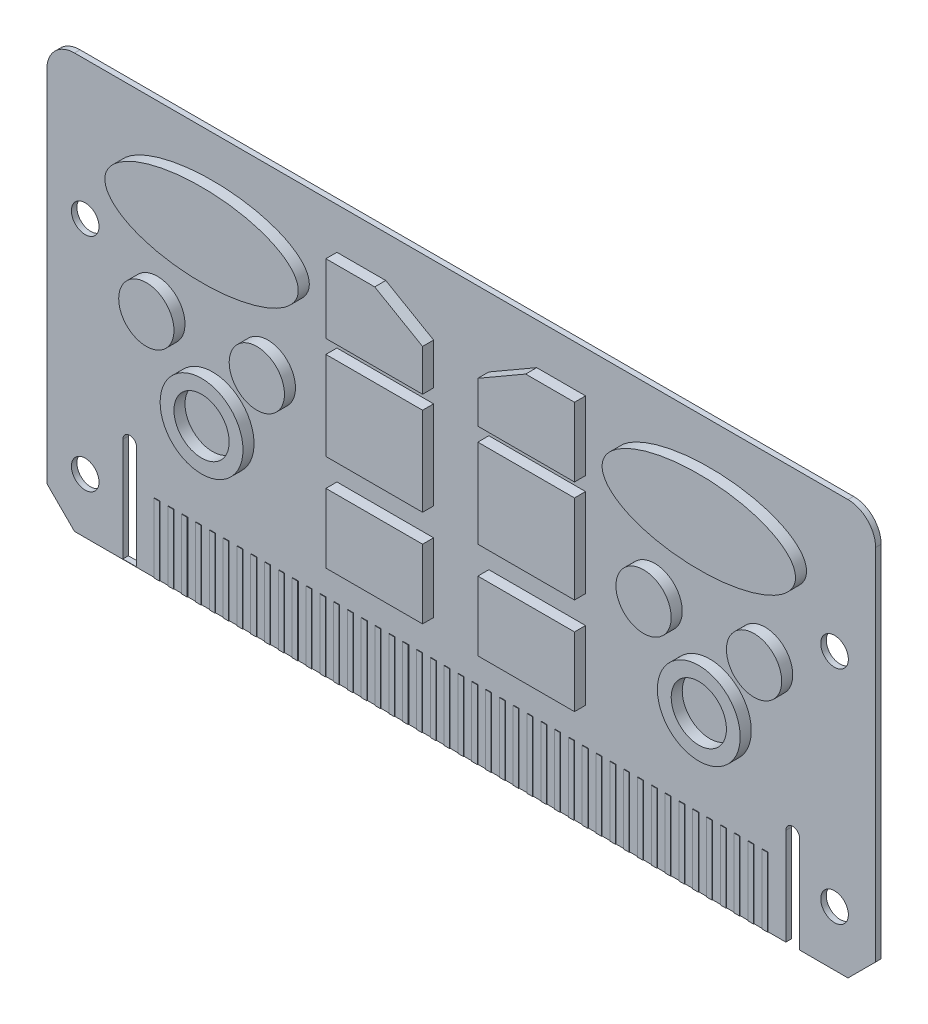
from build123d import *

# Parameters (mm, degrees)
PRINTED_CIRCUITBOARD_BASE_DEPTH = 1
SKETCH2_R                       = 10
SKETCH2_R_2                     = 15
SKETCH2_RX                      = 35
SKETCH2_RY                      = 15
SKETCH2_W                       = 35
SKETCH2_H                       = 25
SKETCH2_H_2                     = 32
CHIPS_DEPTH                     = 4
SLOT_CUTS_DEPTH                 = 10
F_10MM_DOWEL_HOLE_D             = 10.0000054
SKETCH6_W                       = 2
SKETCH6_H                       = 25
LINEAR_SKETCH_PATTERN_DEPTH     = 0.2
FILLETS_R                       = 10
CHAMFERS_SIZE                   = 10


with BuildPart() as part:
    # Sketch1 → Printed CircuitBoard Base (new, symmetric)
    with BuildSketch(Plane.XY):
        Polygon((-299.581607865, 149.862186508), (-299.581607865, -0.137813492), (0.418391866, -0.137813492), (0.418391866, 149.849499231), align=None)
    extrude(amount=PRINTED_CIRCUITBOARD_BASE_DEPTH, both=True)

    # Sketch2 → Chips (add)
    # profile 1 of 14: a face of its own
    with BuildSketch(Plane.XY.offset(1)):
        with Locations((-259.581607865, 84.862186508)):
            Circle(SKETCH2_R)
    # profile 2 of 14: a face of its own
    with BuildSketch(Plane.XY.offset(1)):
        with Locations((-219.581607865, 84.862186508)):
            Circle(SKETCH2_R)
    # profile 3 of 14: a face of its own
    with BuildSketch(Plane.XY.offset(1)):
        with Locations((-239.581607865, 59.862186508)):
            Circle(SKETCH2_R_2)
        with Locations((-239.581607865, 59.862186508)):
            Circle(SKETCH2_R, mode=Mode.SUBTRACT)
    # profile 4 of 14: a face of its own
    with BuildSketch(Plane.XY.offset(1)):
        with Locations((-59.581608134, 59.862186508)):
            Circle(SKETCH2_R_2)
        with Locations((-59.581608134, 59.862186508)):
            Circle(SKETCH2_R, mode=Mode.SUBTRACT)
    # profile 5 of 14: a face of its own
    with BuildSketch(Plane.XY.offset(1)):
        with Locations((-79.581608134, 84.862186508)):
            Circle(SKETCH2_R)
    # profile 6 of 14: a face of its own
    with BuildSketch(Plane.XY.offset(1)):
        with Locations((-39.581608134, 84.862186508)):
            Circle(SKETCH2_R)
    # profile 7 of 14: a face of its own
    with BuildSketch(Plane.XY.offset(1)):
        with Locations(Location((-239.581607865, 119.862186508), (0, 0, 0))):
            Ellipse(SKETCH2_RX, SKETCH2_RY)
    # profile 8 of 14: a face of its own
    with BuildSketch(Plane.XY.offset(1)):
        with Locations((-59.581608134, 119.862186508)):
            Ellipse(SKETCH2_RX, SKETCH2_RY)
    # profile 9 of 14: a face of its own
    with BuildSketch(Plane.XY.offset(1)):
        Polygon((-159.581608134, 124.862186508), (-176.902116209, 134.862186508), (-194.581608134, 134.862186508), (-194.581608134, 109.862186508), (-159.581608134, 109.862186508), align=None)
    # profile 10 of 14: a face of its own
    with BuildSketch(Plane.XY.offset(1)):
        with Locations((-177.081608134, 50.362186508)):
            Rectangle(SKETCH2_W, SKETCH2_H)
    # profile 11 of 14: a face of its own
    with BuildSketch(Plane.XY.offset(1)):
        with Locations((-177.081608134, 88.862186508)):
            Rectangle(SKETCH2_W, SKETCH2_H_2)
    # profile 12 of 14: a face of its own
    with BuildSketch(Plane.XY.offset(1)):
        Polygon((-139.581607865, 124.862186508), (-139.581607865, 109.862186508), (-104.581607865, 109.862186508), (-104.581607865, 134.862186508), (-122.26109979, 134.862186508), align=None)
    # profile 13 of 14: a face of its own
    with BuildSketch(Plane.XY.offset(1)):
        with Locations((-122.081607865, 88.862186508)):
            Rectangle(SKETCH2_W, SKETCH2_H_2)
    # profile 14 of 14: a face of its own
    with BuildSketch(Plane.XY.offset(1)):
        with Locations((-122.081607865, 50.362186508)):
            Rectangle(SKETCH2_W, SKETCH2_H)
    chips = extrude(amount=CHIPS_DEPTH)

    # Mirror2: Chips across plane
    add(chips.mirror(Plane.XY))

    # Sketch4 → Slot Cuts (cut)
    with BuildSketch(Plane.XY.offset(1)):
        with BuildLine():
            Line((-272.081607865, 37.485523666), (-272.081607865, -0.014476334))
            Line((-272.081607865, -0.014476334), (-267.081607865, -0.014476334))
            Line((-267.081607865, -0.014476334), (-267.081607865, 37.485523666))
            ThreePointArc((-267.081607865, 37.485523666), (-269.581607865, 39.985523666), (-272.081607865, 37.485523666))
        make_face()
        with BuildLine():
            Line((-32.081608134, -0.137813492), (-32.081608134, 34.895017162))
            ThreePointArc((-32.081608134, 34.895017162), (-29.581608134, 37.395017162), (-27.081608134, 34.895017162))
            Line((-27.081608134, 34.895017162), (-27.081608134, -0.137813492))
            ThreePointArc((-27.081608134, -0.137813492), (-29.581608134, -2.637813492), (-32.081608134, -0.137813492))
        make_face()
    extrude(amount=-SLOT_CUTS_DEPTH, mode=Mode.SUBTRACT)

    # 10mm Dowel Hole (through all)
    with Locations(Plane(origin=(-285.707893692, 19.76193525, 1), x_dir=(1, 0, 0), z_dir=(0, 0, 1))):
        with Locations((0, 0), (0, 80.080249258), (271.260216811, 80.080249258), (271.260216811, 0)):
            Hole(F_10MM_DOWEL_HOLE_D / 2)

    # Sketch6 → Linear Sketch Pattern (add)
    with BuildSketch(Plane.XY.offset(1)):
        with Locations((-259.581607865, 12.362186508)):
            Rectangle(SKETCH6_W, SKETCH6_H)
        with Locations((-254.581607865, 12.362186508)):
            Rectangle(SKETCH6_W, SKETCH6_H)
        with Locations((-249.581607865, 12.362186508)):
            Rectangle(SKETCH6_W, SKETCH6_H)
        with Locations((-244.581607865, 12.362186508)):
            Rectangle(SKETCH6_W, SKETCH6_H)
        with Locations((-239.581607865, 12.362186508)):
            Rectangle(SKETCH6_W, SKETCH6_H)
        with Locations((-234.581607865, 12.362186508)):
            Rectangle(SKETCH6_W, SKETCH6_H)
        with Locations((-229.581607865, 12.362186508)):
            Rectangle(SKETCH6_W, SKETCH6_H)
        with Locations((-224.581607865, 12.362186508)):
            Rectangle(SKETCH6_W, SKETCH6_H)
        with Locations((-219.581607865, 12.362186508)):
            Rectangle(SKETCH6_W, SKETCH6_H)
        with Locations((-214.581607865, 12.362186508)):
            Rectangle(SKETCH6_W, SKETCH6_H)
        with Locations((-209.581607865, 12.362186508)):
            Rectangle(SKETCH6_W, SKETCH6_H)
        with Locations((-204.581607865, 12.362186508)):
            Rectangle(SKETCH6_W, SKETCH6_H)
        with Locations((-199.581607865, 12.362186508)):
            Rectangle(SKETCH6_W, SKETCH6_H)
        with Locations((-194.581607865, 12.362186508)):
            Rectangle(SKETCH6_W, SKETCH6_H)
        with Locations((-189.581607865, 12.362186508)):
            Rectangle(SKETCH6_W, SKETCH6_H)
        with Locations((-184.581607865, 12.362186508)):
            Rectangle(SKETCH6_W, SKETCH6_H)
        with Locations((-179.581607865, 12.362186508)):
            Rectangle(SKETCH6_W, SKETCH6_H)
        with Locations((-174.581607865, 12.362186508)):
            Rectangle(SKETCH6_W, SKETCH6_H)
        with Locations((-169.581607865, 12.362186508)):
            Rectangle(SKETCH6_W, SKETCH6_H)
        with Locations((-164.581607865, 12.362186508)):
            Rectangle(SKETCH6_W, SKETCH6_H)
        with Locations((-159.581607865, 12.362186508)):
            Rectangle(SKETCH6_W, SKETCH6_H)
        with Locations((-154.581607865, 12.362186508)):
            Rectangle(SKETCH6_W, SKETCH6_H)
        with Locations((-149.581607865, 12.362186508)):
            Rectangle(SKETCH6_W, SKETCH6_H)
        with Locations((-144.581607865, 12.362186508)):
            Rectangle(SKETCH6_W, SKETCH6_H)
        with Locations((-139.581607865, 12.362186508)):
            Rectangle(SKETCH6_W, SKETCH6_H)
        with Locations((-134.581607865, 12.362186508)):
            Rectangle(SKETCH6_W, SKETCH6_H)
        with Locations((-129.581607865, 12.362186508)):
            Rectangle(SKETCH6_W, SKETCH6_H)
        with Locations((-124.581607865, 12.362186508)):
            Rectangle(SKETCH6_W, SKETCH6_H)
        with Locations((-119.581607865, 12.362186508)):
            Rectangle(SKETCH6_W, SKETCH6_H)
        with Locations((-114.581607865, 12.362186508)):
            Rectangle(SKETCH6_W, SKETCH6_H)
        with Locations((-109.581607865, 12.362186508)):
            Rectangle(SKETCH6_W, SKETCH6_H)
        with Locations((-104.581607865, 12.362186508)):
            Rectangle(SKETCH6_W, SKETCH6_H)
        with Locations((-99.581607865, 12.362186508)):
            Rectangle(SKETCH6_W, SKETCH6_H)
        with Locations((-94.581607865, 12.362186508)):
            Rectangle(SKETCH6_W, SKETCH6_H)
        with Locations((-89.581607865, 12.362186508)):
            Rectangle(SKETCH6_W, SKETCH6_H)
        with Locations((-84.581607865, 12.362186508)):
            Rectangle(SKETCH6_W, SKETCH6_H)
        with Locations((-79.581607865, 12.362186508)):
            Rectangle(SKETCH6_W, SKETCH6_H)
        with Locations((-74.581607865, 12.362186508)):
            Rectangle(SKETCH6_W, SKETCH6_H)
        with Locations((-69.581607865, 12.362186508)):
            Rectangle(SKETCH6_W, SKETCH6_H)
        with Locations((-64.581607865, 12.362186508)):
            Rectangle(SKETCH6_W, SKETCH6_H)
        with Locations((-59.581607865, 12.362186508)):
            Rectangle(SKETCH6_W, SKETCH6_H)
        with Locations((-54.581607865, 12.362186508)):
            Rectangle(SKETCH6_W, SKETCH6_H)
        with Locations((-49.581607865, 12.362186508)):
            Rectangle(SKETCH6_W, SKETCH6_H)
        with Locations((-44.581607865, 12.362186508)):
            Rectangle(SKETCH6_W, SKETCH6_H)
        with Locations((-39.581607865, 12.362186508)):
            Rectangle(SKETCH6_W, SKETCH6_H)
    extrude(amount=LINEAR_SKETCH_PATTERN_DEPTH)

    # Fillets
    fillets_edges = [part.edges().sort_by_distance(p)[0] for p in [
        (-299.581607865, 149.862186508, 0),
        (0.418391866, 149.849499231, 0),
    ]]
    fillet(fillets_edges, radius=FILLETS_R)

    # Chamfers
    chamfers_edges = [part.edges().sort_by_distance(p)[0] for p in [
        (0.418391866, -0.137813492, 0),
        (-299.581607865, -0.137813492, 0),
    ]]
    chamfer(chamfers_edges, length=CHAMFERS_SIZE)


solid = part.part
